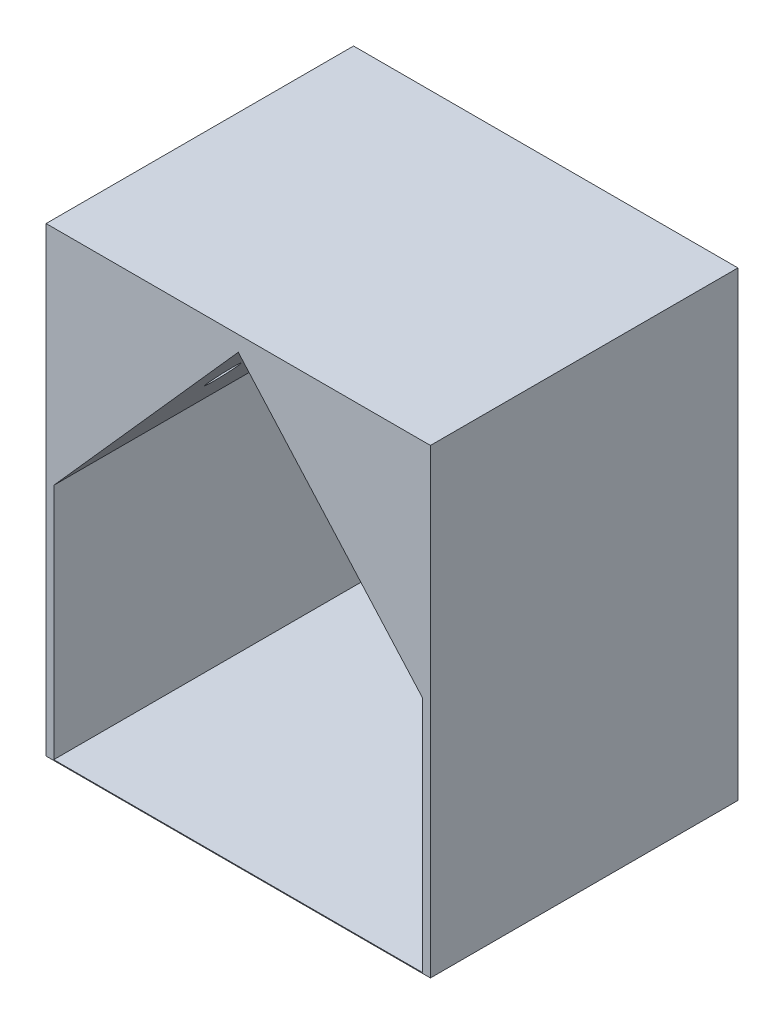
from build123d import *

# Parameters (mm, degrees)
SKETCH1_W               = 2500
SKETCH1_H               = 3000
BOSS_EXTRUDE1_DEPTH     = 2000
CUT_EXTRUDE4_DEPTH      = 2796.084971875
CUT_EXTRUDE4_DEPTH_BACK = 1995
SKETCH6_R               = 100
CUT_EXTRUDE5_DEPTH      = 20
SKETCH3_R               = 100
CUT_EXTRUDE6_DEPTH      = 20


with BuildPart() as part:
    # Sketch1 → Boss-Extrude1 (new body)
    with BuildSketch(Plane.XY):
        Rectangle(SKETCH1_W, SKETCH1_H)
    extrude(amount=BOSS_EXTRUDE1_DEPTH)

    # Sketch2 → Cut-Extrude4 (cut, two sides: drawn at the far end of the back side and taken through both)
    with BuildSketch(Plane.XY.offset(2000).offset(-CUT_EXTRUDE4_DEPTH_BACK)):
        Polygon((-1200, -1495), (-1200, 50.500700421), (0, 1400), (1200, 50.500700421), (1200, -1495), align=None)
    extrude(amount=CUT_EXTRUDE4_DEPTH + CUT_EXTRUDE4_DEPTH_BACK, mode=Mode.SUBTRACT)

    # Sketch6 → Cut-Extrude5 (cut)
    with BuildSketch(Plane(origin=(695.202601453, 618.187146895, 0), x_dir=(0.6645015032202684, -0.7472869276375734, 0), z_dir=(-0.7472869276375734, -0.6645015032202684, 0))):
        with Locations((-143.269204045, 1500)):
            Circle(SKETCH6_R)
        with Locations((-143.269204045, 1002.5)):
            Circle(SKETCH6_R)
        with Locations((-143.269204045, 502.5)):
            Circle(SKETCH6_R)
    extrude(amount=-CUT_EXTRUDE5_DEPTH, mode=Mode.SUBTRACT)

    # Sketch3 → Cut-Extrude6 (cut)
    with BuildSketch(Plane(origin=(-695.202601453, 618.187146895, 0), x_dir=(0.6645015032202681, 0.7472869276375735, 0), z_dir=(0.7472869276375735, -0.6645015032202681, 0))):
        with Locations((143.269204045, 1500)):
            Circle(SKETCH3_R)
        with Locations((143.269204045, 1000)):
            Circle(SKETCH3_R)
        with Locations((143.269204045, 502.5)):
            Circle(SKETCH3_R)
    extrude(amount=-CUT_EXTRUDE6_DEPTH, mode=Mode.SUBTRACT)


solid = part.part
